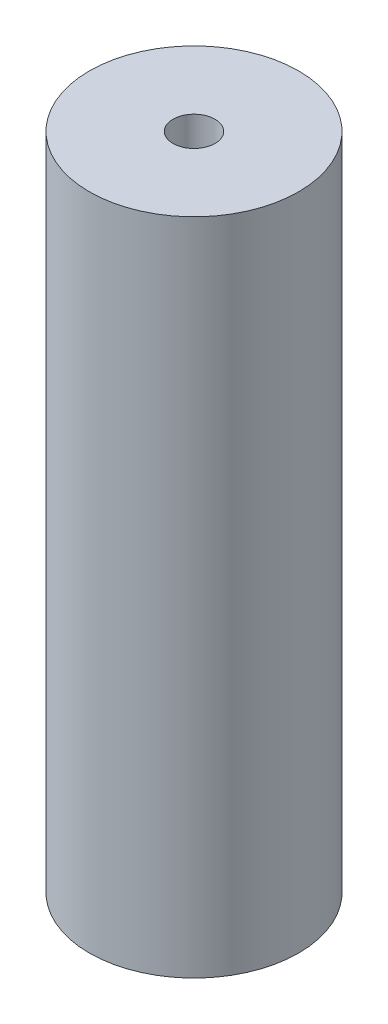
from build123d import *

# Parameters (mm, degrees)
SKETCH1_R                       = 12.7
BOSS_EXTRUDE1_DEPTH             = 80
TAP_DRILL_FOR_1_4_20_TAP1_D     = 5.1054
TAP_DRILL_FOR_1_4_20_TAP1_DEPTH = 7.62
TAP_DRILL_FOR_1_4_20_TAP1_TIP   = 1.533816902
TAP_DRILL_FOR_1_4_20_TAP2_D     = 5.1054
TAP_DRILL_FOR_1_4_20_TAP2_DEPTH = 7.62
TAP_DRILL_FOR_1_4_20_TAP2_TIP   = 1.533816902


with BuildPart() as part:
    # Sketch1 → Boss-Extrude1 (new body)
    with BuildSketch(Plane(origin=(0, 0, 0), x_dir=(1, 0, 0), z_dir=(0, 1, 0))):
        with Locations(Location((0, 0, 0), (0, 0, 270))):
            Circle(SKETCH1_R)
    extrude(amount=BOSS_EXTRUDE1_DEPTH)

    # Tap Drill for 1/4-20 Tap1
    with Locations(Plane.XZ):
        with Locations((0, 0)):
            Hole(TAP_DRILL_FOR_1_4_20_TAP1_D / 2, depth=TAP_DRILL_FOR_1_4_20_TAP1_DEPTH)
            with Locations((0, 0, -(TAP_DRILL_FOR_1_4_20_TAP1_DEPTH + TAP_DRILL_FOR_1_4_20_TAP1_TIP / 2))):  # 118° drill point
                Cone(0, TAP_DRILL_FOR_1_4_20_TAP1_D / 2, TAP_DRILL_FOR_1_4_20_TAP1_TIP, mode=Mode.SUBTRACT)

    # Tap Drill for 1/4-20 Tap2
    with Locations(Plane(origin=(0, 80, 0), x_dir=(1, 0, 0), z_dir=(0, 1, 0))):
        with Locations((0, 0)):
            Hole(TAP_DRILL_FOR_1_4_20_TAP2_D / 2, depth=TAP_DRILL_FOR_1_4_20_TAP2_DEPTH)
            with Locations((0, 0, -(TAP_DRILL_FOR_1_4_20_TAP2_DEPTH + TAP_DRILL_FOR_1_4_20_TAP2_TIP / 2))):  # 118° drill point
                Cone(0, TAP_DRILL_FOR_1_4_20_TAP2_D / 2, TAP_DRILL_FOR_1_4_20_TAP2_TIP, mode=Mode.SUBTRACT)


solid = part.part
